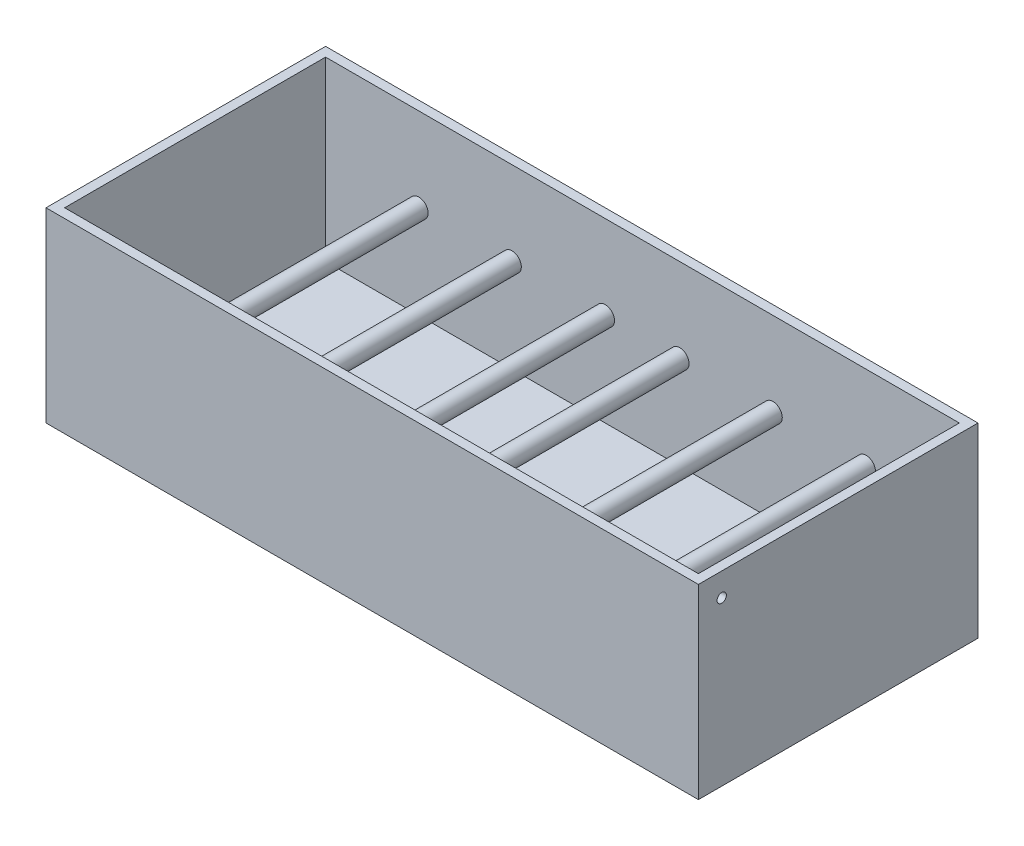
from build123d import *

# Parameters (mm, degrees)
CROQUIS1_W              = 700
CROQUIS1_H              = 300
SALIENTE_EXTRUIR1_DEPTH = 200
CROQUIS2_W              = 680
CROQUIS2_H              = 280
CORTAR_EXTRUIR1_DEPTH   = 190
CROQUIS3_R              = 5
CORTAR_EXTRUIR2_DEPTH   = 700
CROQUIS4_R              = 10
SALIENTE_EXTRUIR2_DEPTH = 280


with BuildPart() as part:
    # Croquis1 → Saliente-Extruir1 (new body)
    with BuildSketch(Plane(origin=(0, 0, 0), x_dir=(1, 0, 0), z_dir=(0, 1, 0))):
        Rectangle(CROQUIS1_W, CROQUIS1_H)
    extrude(amount=SALIENTE_EXTRUIR1_DEPTH)

    # Croquis2 → Cortar-Extruir1 (cut)
    with BuildSketch(Plane(origin=(0, 200, 0), x_dir=(1, 0, 0), z_dir=(0, 1, 0))):
        Rectangle(CROQUIS2_W, CROQUIS2_H)
    extrude(amount=-CORTAR_EXTRUIR1_DEPTH, mode=Mode.SUBTRACT)

    # Croquis3 → Cortar-Extruir2 (cut)
    with BuildSketch(Plane(origin=(350, 0, 0), x_dir=(0, 0, -1), z_dir=(1, 0, 0))):
        with Locations((-125, 175)):
            Circle(CROQUIS3_R)
    extrude(amount=-CORTAR_EXTRUIR2_DEPTH, mode=Mode.SUBTRACT)

    # Croquis4 → Saliente-Extruir2 (add)
    with BuildSketch(Plane(origin=(0, 0, 140), x_dir=(-1, 0, 0), z_dir=(0, 0, -1))):
        with Locations(Location((-240, 110, 0), (0, 0, 180))):
            Circle(CROQUIS4_R)
        with Locations(Location((-140, 110, 0), (0, 0, 180))):
            Circle(CROQUIS4_R)
        with Locations(Location((-40, 110, 0), (0, 0, 180))):
            Circle(CROQUIS4_R)
        with Locations(Location((140, 110, 0), (0, 0, 180))):
            Circle(CROQUIS4_R)
        with Locations(Location((240, 110, 0), (0, 0, 180))):
            Circle(CROQUIS4_R)
        with Locations(Location((40, 110, 0), (0, 0, 180))):
            Circle(CROQUIS4_R)
    extrude(amount=SALIENTE_EXTRUIR2_DEPTH)


solid = part.part
